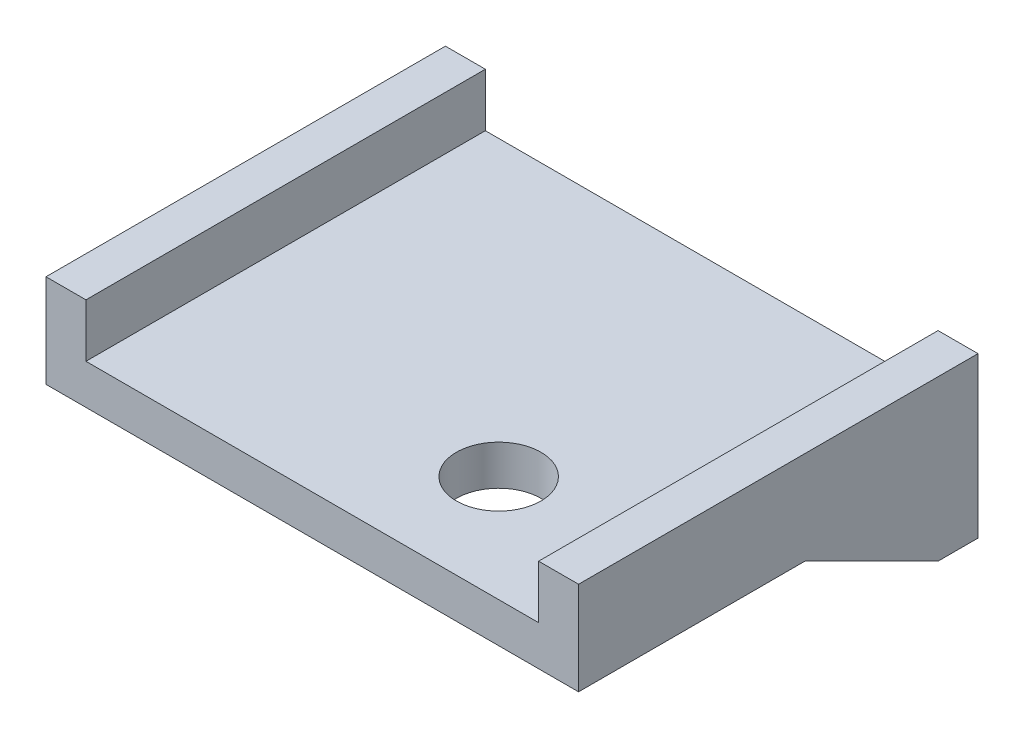
from build123d import *

# Parameters (mm, degrees)
SKETCH1_W           = 40
SKETCH1_H           = 30
BOSS_EXTRUDE2_DEPTH = 3
SKETCH2_W           = 3
SKETCH2_H           = 30
BOSS_EXTRUDE3_DEPTH = 4
SKETCH3_W           = 3
SKETCH3_H           = 30
BOSS_EXTRUDE4_DEPTH = 4
SKETCH4_R           = 3.175
CUT_EXTRUDE1_DEPTH  = 43.489507814
SKETCH5_W           = 40
SKETCH5_H           = 3
BOSS_EXTRUDE5_DEPTH = 5
RIB4_REACH          = 50.765
SKETCH8_WALL_W      = 110.70982261
SKETCH8_WALL_H      = 3
RIB5_REACH          = 50.765
SKETCH10_WALL_W     = 110.70982261
SKETCH10_WALL_H     = 3


with BuildPart() as part:
    # Sketch1 → Boss-Extrude2 (new body)
    with BuildSketch(Plane(origin=(0, 0, 0), x_dir=(1, 0, 0), z_dir=(0, 1, 0))):
        with Locations((-19.478413565, 0.192535557)):
            Rectangle(SKETCH1_W, SKETCH1_H)
    extrude(amount=BOSS_EXTRUDE2_DEPTH)

    # Sketch2 → Boss-Extrude3 (add)
    with BuildSketch(Plane(origin=(0, 3, 0), x_dir=(1, 0, 0), z_dir=(0, 1, 0))):
        with Locations((-0.978413565, 0.192535557)):
            Rectangle(SKETCH2_W, SKETCH2_H)
    extrude(amount=BOSS_EXTRUDE3_DEPTH)

    # Sketch3 → Boss-Extrude4 (add)
    with BuildSketch(Plane(origin=(0, 3, 0), x_dir=(1, 0, 0), z_dir=(0, 1, 0))):
        with Locations((-37.978413565, 0.192535557)):
            Rectangle(SKETCH3_W, SKETCH3_H)
    extrude(amount=BOSS_EXTRUDE4_DEPTH)

    # Sketch4 → Cut-Extrude1 (cut, through all)
    with BuildSketch(Plane(origin=(0, 3, 0), x_dir=(1, 0, 0), z_dir=(0, 1, 0))):
        with Locations(Location((-13.478413565, -6.807464443, 0), (0, 0, 270))):
            Circle(SKETCH4_R)
    extrude(amount=-CUT_EXTRUDE1_DEPTH, mode=Mode.SUBTRACT)

    # Sketch5 → Boss-Extrude5 (add)
    with BuildSketch(Plane(origin=(0, 0, 0), x_dir=(-1, 0, 0), z_dir=(0, -1, 0))):
        with Locations((19.478413565, 13.692535557)):
            Rectangle(SKETCH5_W, SKETCH5_H)
    extrude(amount=BOSS_EXTRUDE5_DEPTH)

    # Sketch8 wall → Rib4 (add, up to next)
    with BuildSketch(Plane(origin=(0.521586435, -2.5, -7.192535557), x_dir=(0, 0.4472135955, 0.894427191), z_dir=(0, 0.894427191, -0.4472135955)), mode=Mode.PRIVATE) as rib4_sk1:
        with Locations((0, -1.5)):
            Rectangle(SKETCH8_WALL_W, SKETCH8_WALL_H)
    rib4_tool1 = extrude(rib4_sk1.sketch, amount=RIB4_REACH, mode=Mode.PRIVATE) - part.part
    add(rib4_tool1.solids().sort_by_distance((0.521586435, -2.5, -7.192535557))[0])

    # Sketch10 wall → Rib5 (add, up to next)
    with BuildSketch(Plane(origin=(-39.478413565, -2.5, -7.192535557), x_dir=(0, 0.4472135955, 0.894427191), z_dir=(0, 0.894427191, -0.4472135955)), mode=Mode.PRIVATE) as rib5_sk1:
        with Locations((0, 1.5)):
            Rectangle(SKETCH10_WALL_W, SKETCH10_WALL_H)
    rib5_tool1 = extrude(rib5_sk1.sketch, amount=RIB5_REACH, mode=Mode.PRIVATE) - part.part
    add(rib5_tool1.solids().sort_by_distance((-39.478413565, -2.5, -7.192535557))[0])


solid = part.part
